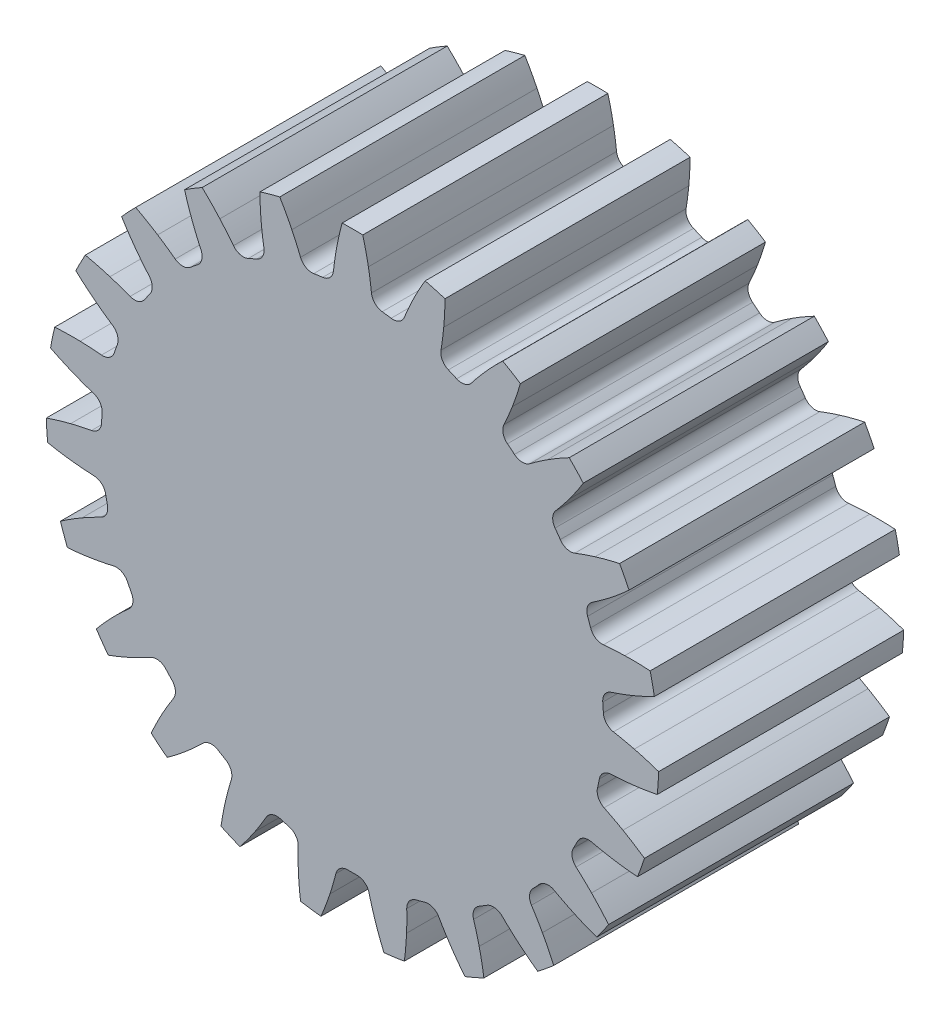
from build123d import *

# Parameters (mm, degrees)
BOSS_EXTRUDE1_DEPTH = 50


with BuildPart() as part:
    # Sketch1 → Boss-Extrude1 (new body)
    with BuildSketch(Plane.XY):
        with BuildLine():
            ThreePointArc((-6.067010261, 50.889624547), (-6.978540766, 50.772654734), (-7.887827325, 50.639359002))
            ThreePointArc((-7.887827325, 50.639359002), (-9.506716456, 50.935415462), (-10.590798202, 52.173647351))
            ThreePointArc((-10.590798202, 52.173647351), (-11.440918064, 54.179954393), (-12.359033088, 56.15607092))
            ThreePointArc((-12.359033088, 56.15607092), (-13.543777735, 58.463181503), (-14.830650776, 60.714922363))
            ThreePointArc((-14.830650776, 60.714922363), (-16.862298197, 60.182330459), (-18.874903383, 59.581775924))
            ThreePointArc((-18.874903383, 59.581775924), (-18.80446427, 56.989206262), (-18.617995455, 54.402391907))
            ThreePointArc((-18.617995455, 54.402391907), (-18.375692316, 52.23692177), (-18.059606285, 50.080985467))
            ThreePointArc((-18.059606285, 50.080985467), (-18.342501349, 48.459744637), (-19.571885451, 47.365639444))
            ThreePointArc((-19.571885451, 47.365639444), (-20.418055855, 47.007079202), (-21.257660843, 46.633403859))
            ThreePointArc((-21.257660843, 46.633403859), (-22.89639225, 46.481710683), (-24.274344271, 47.38154382))
            ThreePointArc((-24.274344271, 47.38154382), (-25.634234544, 49.08409196), (-27.05145323, 50.739224256))
            ThreePointArc((-27.05145323, 50.739224256), (-28.814715318, 52.641140641), (-30.661380029, 54.46218665))
            ThreePointArc((-30.661380029, 54.46218665), (-32.473996877, 53.401212784), (-34.249941528, 52.27993406))
            ThreePointArc((-34.249941528, 52.27993406), (-33.482647565, 49.802508158), (-32.60517936, 47.361928581))
            ThreePointArc((-32.60517936, 47.361928581), (-31.787624627, 45.342132556), (-30.90159527, 43.351423209))
            ThreePointArc((-30.90159527, 43.351423209), (-30.736594276, 41.713978213), (-31.625203432, 40.328761546))
            ThreePointArc((-31.625203432, 40.328761546), (-32.343257147, 39.755203649), (-33.050910904, 39.168862486))
            ThreePointArc((-33.050910904, 39.168862486), (-34.587947376, 38.580670061), (-36.157573272, 39.075367939))
            ThreePointArc((-36.157573272, 39.075367939), (-37.926377116, 40.347886971), (-39.737590838, 41.559281447))
            ThreePointArc((-39.737590838, 41.559281447), (-41.948597285, 42.914947194), (-44.218094992, 44.170239701))
            ThreePointArc((-44.218094992, 44.170239701), (-45.677247767, 42.659571451), (-47.084818194, 41.100728651))
            ThreePointArc((-47.084818194, 41.100728651), (-45.677576063, 38.922185856), (-44.174186269, 36.808847679))
            ThreePointArc((-44.174186269, 36.808847679), (-42.842014238, 35.084524796), (-41.451754299, 33.406684212))
            ThreePointArc((-41.451754299, 33.406684212), (-40.851094617, 31.874476853), (-41.333024751, 30.300883897))
            ThreePointArc((-41.333024751, 30.300883897), (-41.869707017, 29.554866508), (-42.3929261, 28.799345768))
            ThreePointArc((-42.3929261, 28.799345768), (-43.714272674, 27.818277637), (-45.359160474, 27.871150776))
            ThreePointArc((-45.359160474, 27.871150776), (-47.405693799, 28.619263784), (-49.476573122, 29.297076853))
            ThreePointArc((-49.476573122, 29.297076853), (-51.971343693, 30.005948437), (-54.495356134, 30.602388139))
            ThreePointArc((-54.495356134, 30.602388139), (-55.49282615, 28.754064858), (-56.427629293, 26.873270221))
            ThreePointArc((-56.427629293, 26.873270221), (-54.484807706, 25.155183086), (-52.466995867, 23.525822933))
            ThreePointArc((-52.466995867, 23.525822933), (-50.719007642, 22.224858333), (-48.927626341, 20.984324272))
            ThreePointArc((-48.927626341, 20.984324272), (-47.935856151, 19.670991361), (-47.97536471, 18.025728307))
            ThreePointArc((-47.97536471, 18.025728307), (-48.290872259, 17.162580124), (-48.590851903, 16.293913322))
            ThreePointArc((-48.590851903, 16.293913322), (-49.598510347, 14.99273082), (-51.196666248, 14.599857862))
            ThreePointArc((-51.196666248, 14.599857862), (-53.36914704, 14.768080728), (-55.546104317, 14.862042094))
            ThreePointArc((-55.546104317, 14.862042094), (-58.139613292, 14.871545752), (-60.730946011, 14.764897445))
            ThreePointArc((-60.730946011, 14.764897445), (-61.19275548, 12.716000816), (-61.585461266, 10.652744276))
            ThreePointArc((-61.585461266, 10.652744276), (-59.251150412, 9.522535464), (-56.868568402, 8.497995524))
            ThreePointArc((-56.868568402, 8.497995524), (-54.834404274, 7.7168758), (-52.774760166, 7.005652998))
            ThreePointArc((-52.774760166, 7.005652998), (-51.465434526, 6.008598429), (-51.059591341, 4.41368691))
            ThreePointArc((-51.059591341, 4.41368691), (-51.130524421, 3.497423685), (-51.185016508, 2.580035865))
            ThreePointArc((-51.185016508, 2.580035865), (-51.804253406, 1.055241745), (-53.237149495, 0.245760281))
            ThreePointArc((-53.237149495, 0.245760281), (-55.374454792, -0.178383317), (-57.496035061, -0.675242337))
            ThreePointArc((-57.496035061, -0.675242337), (-59.995933745, -1.365811448), (-62.462399448, -2.167638148))
            ThreePointArc((-62.462399448, -2.167638148), (-62.354298074, -4.265150835), (-62.175781312, -6.357846978))
            ThreePointArc((-62.175781312, -6.357846978), (-59.623106348, -6.816355051), (-57.052459375, -7.160089337))
            ThreePointArc((-57.052459375, -7.160089337), (-54.882983991, -7.363432109), (-52.707831458, -7.49259551))
            ThreePointArc((-52.707831458, -7.49259551), (-51.178057062, -8.099424762), (-50.356961664, -9.525697454))
            ThreePointArc((-50.356961664, -9.525697454), (-50.178059494, -10.427120669), (-49.983022595, -11.325191049))
            ThreePointArc((-49.983022595, -11.325191049), (-50.167911978, -12.960509782), (-51.329276908, -14.126564217))
            ThreePointArc((-51.329276908, -14.126564217), (-53.272892554, -15.111617487), (-55.181747912, -16.162447134))
            ThreePointArc((-55.181747912, -16.162447134), (-57.402630255, -17.501872662), (-59.561302465, -18.939409935))
            ThreePointArc((-59.561302465, -18.939409935), (-58.891307632, -20.929975761), (-58.154808094, -22.896905808))
            ThreePointArc((-58.154808094, -22.896905808), (-55.573089245, -22.649707694), (-53.005030433, -22.287143127))
            ThreePointArc((-53.005030433, -22.287143127), (-50.861143858, -21.897627944), (-48.731804013, -21.435152486))
            ThreePointArc((-48.731804013, -21.435152486), (-47.095037228, -21.60675067), (-45.919586508, -22.758604415))
            ThreePointArc((-45.919586508, -22.758604415), (-45.504117443, -23.578333184), (-45.074016553, -24.390480352))
            ThreePointArc((-45.074016553, -24.390480352), (-44.810846022, -26.01503959), (-45.614546669, -27.451186071))
            ThreePointArc((-45.614546669, -27.451186071), (-47.220323582, -28.92409212), (-48.77488296, -30.450957164))
            ThreePointArc((-48.77488296, -30.450957164), (-50.552036278, -32.339900045), (-52.242816152, -34.30653233))
            ThreePointArc((-52.242816152, -34.30653233), (-51.060618313, -36.042520132), (-49.820758799, -37.73780588))
            ThreePointArc((-49.820758799, -37.73780588), (-47.401470341, -36.803235134), (-45.026460866, -35.761261469))
            ThreePointArc((-45.026460866, -35.761261469), (-43.06716536, -34.80777689), (-41.141561598, -33.787962261))
            ThreePointArc((-41.141561598, -33.787962261), (-39.51919393, -33.511602725), (-38.07656569, -34.3036098))
            ThreePointArc((-38.07656569, -34.3036098), (-37.455343169, -34.98084859), (-36.822076903, -35.646839307))
            ThreePointArc((-36.822076903, -35.646839307), (-36.130364612, -37.140152922), (-36.516794176, -38.739879035))
            ThreePointArc((-36.516794176, -38.739879035), (-37.665639229, -40.591399158), (-38.750608069, -42.481059006))
            ThreePointArc((-38.750608069, -42.481059006), (-39.952229031, -44.779424988), (-41.049719161, -47.129296163))
            ThreePointArc((-41.049719161, -47.129296163), (-39.44299652, -48.481955669), (-37.79173174, -49.779865529))
            ThreePointArc((-37.79173174, -49.779865529), (-35.71430123, -48.227234987), (-33.70848468, -46.583130644))
            ThreePointArc((-33.70848468, -46.583130644), (-32.079092226, -45.136392258), (-30.500037769, -43.634873445))
            ThreePointArc((-30.500037769, -43.634873445), (-29.012392805, -42.931052512), (-27.409580182, -43.304473374))
            ThreePointArc((-27.409580182, -43.304473374), (-26.628677439, -43.788994483), (-25.839212259, -44.259435263))
            ThreePointArc((-25.839212259, -44.259435263), (-24.770259345, -45.510751016), (-24.710758112, -47.155412394))
            ThreePointArc((-24.710758112, -47.155412394), (-25.317466723, -49.248227815), (-25.85237785, -51.360535039))
            ThreePointArc((-25.85237785, -51.360535039), (-26.389347726, -53.897864832), (-26.812152289, -56.456695702))
            ThreePointArc((-26.812152289, -56.456695702), (-24.900068115, -57.325706344), (-22.959864822, -58.12998028))
            ThreePointArc((-22.959864822, -58.12998028), (-21.378365779, -56.074441446), (-19.89050439, -53.950142123))
            ThreePointArc((-19.89050439, -53.950142123), (-18.711859574, -52.117447898), (-17.596465667, -50.245585682))
            ThreePointArc((-17.596465667, -50.245585682), (-16.35387523, -49.16650253), (-14.709751504, -49.093642264))
            ThreePointArc((-14.709751504, -49.093642264), (-13.827084522, -49.349510977), (-12.939971448, -49.58951138))
            ThreePointArc((-12.939971448, -49.58951138), (-11.573057258, -50.506024906), (-11.072038163, -52.073644538))
            ThreePointArc((-11.072038163, -52.073644538), (-11.09161353, -54.25254071), (-11.036795032, -56.430835147))
            ThreePointArc((-11.036795032, -56.430835147), (-10.869289223, -59.018946607), (-10.586050739, -61.596960394))
            ThreePointArc((-10.586050739, -61.596960394), (-8.510415569, -61.917871627), (-6.425169766, -62.16886032))
            ThreePointArc((-6.425169766, -62.16886032), (-5.456894737, -59.762863106), (-4.597336383, -57.315918366))
            ThreePointArc((-4.597336383, -57.315918366), (-3.956853898, -55.233190849), (-3.387844205, -53.129812687))
            ThreePointArc((-3.387844205, -53.129812687), (-2.482465542, -51.755497977), (-0.918967848, -51.241760295))
            ThreePointArc((-0.918967848, -51.241760295), (0, -51.25), (0.918967848, -51.241760295))
            ThreePointArc((0.918967848, -51.241760295), (2.482465542, -51.755497977), (3.387844205, -53.129812687))
            ThreePointArc((3.387844205, -53.129812687), (3.956853898, -55.233190849), (4.597336383, -57.315918366))
            ThreePointArc((4.597336383, -57.315918366), (5.456894737, -59.762863106), (6.425169766, -62.16886032))
            ThreePointArc((6.425169766, -62.16886032), (8.510415569, -61.917871627), (10.586050739, -61.596960394))
            ThreePointArc((10.586050739, -61.596960394), (10.869289223, -59.018946607), (11.036795032, -56.430835147))
            ThreePointArc((11.036795032, -56.430835147), (11.09161353, -54.25254071), (11.072038163, -52.073644538))
            ThreePointArc((11.072038163, -52.073644538), (11.573057258, -50.506024906), (12.939971448, -49.58951138))
            ThreePointArc((12.939971448, -49.58951138), (13.827084522, -49.349510977), (14.709751504, -49.093642264))
            ThreePointArc((14.709751504, -49.093642264), (16.35387523, -49.16650253), (17.596465667, -50.245585682))
            ThreePointArc((17.596465667, -50.245585682), (18.711859574, -52.117447898), (19.89050439, -53.950142123))
            ThreePointArc((19.89050439, -53.950142123), (21.378365779, -56.074441446), (22.959864822, -58.12998028))
            ThreePointArc((22.959864822, -58.12998028), (24.900068115, -57.325706344), (26.812152289, -56.456695702))
            ThreePointArc((26.812152289, -56.456695702), (26.389347726, -53.897864832), (25.85237785, -51.360535039))
            ThreePointArc((25.85237785, -51.360535039), (25.317466723, -49.248227815), (24.710758112, -47.155412394))
            ThreePointArc((24.710758112, -47.155412394), (24.770259345, -45.510751016), (25.839212259, -44.259435263))
            ThreePointArc((25.839212259, -44.259435263), (26.628677439, -43.788994483), (27.409580182, -43.304473374))
            ThreePointArc((27.409580182, -43.304473374), (29.012392805, -42.931052512), (30.500037769, -43.634873445))
            ThreePointArc((30.500037769, -43.634873445), (32.079092226, -45.136392258), (33.70848468, -46.583130644))
            ThreePointArc((33.70848468, -46.583130644), (35.71430123, -48.227234987), (37.79173174, -49.779865529))
            ThreePointArc((37.79173174, -49.779865529), (39.44299652, -48.481955669), (41.049719161, -47.129296163))
            ThreePointArc((41.049719161, -47.129296163), (39.952229031, -44.779424988), (38.750608069, -42.481059006))
            ThreePointArc((38.750608069, -42.481059006), (37.665639229, -40.591399158), (36.516794176, -38.739879035))
            ThreePointArc((36.516794176, -38.739879035), (36.130364612, -37.140152922), (36.822076903, -35.646839307))
            ThreePointArc((36.822076903, -35.646839307), (37.455343169, -34.98084859), (38.07656569, -34.3036098))
            ThreePointArc((38.07656569, -34.3036098), (39.51919393, -33.511602725), (41.141561598, -33.787962261))
            ThreePointArc((41.141561598, -33.787962261), (43.06716536, -34.80777689), (45.026460866, -35.761261469))
            ThreePointArc((45.026460866, -35.761261469), (47.401470341, -36.803235134), (49.820758799, -37.73780588))
            ThreePointArc((49.820758799, -37.73780588), (51.060618313, -36.042520132), (52.242816152, -34.30653233))
            ThreePointArc((52.242816152, -34.30653233), (50.552036278, -32.339900045), (48.77488296, -30.450957164))
            ThreePointArc((48.77488296, -30.450957164), (47.220323582, -28.92409212), (45.614546669, -27.451186071))
            ThreePointArc((45.614546669, -27.451186071), (44.810846022, -26.01503959), (45.074016553, -24.390480352))
            ThreePointArc((45.074016553, -24.390480352), (45.504117443, -23.578333184), (45.919586508, -22.758604415))
            ThreePointArc((45.919586508, -22.758604415), (47.095037228, -21.60675067), (48.731804013, -21.435152486))
            ThreePointArc((48.731804013, -21.435152486), (50.861143858, -21.897627944), (53.005030433, -22.287143127))
            ThreePointArc((53.005030433, -22.287143127), (55.573089245, -22.649707694), (58.154808094, -22.896905808))
            ThreePointArc((58.154808094, -22.896905808), (58.891307632, -20.929975761), (59.561302465, -18.939409935))
            ThreePointArc((59.561302465, -18.939409935), (57.402630255, -17.501872662), (55.181747912, -16.162447134))
            ThreePointArc((55.181747912, -16.162447134), (53.272892554, -15.111617487), (51.329276908, -14.126564217))
            ThreePointArc((51.329276908, -14.126564217), (50.167911978, -12.960509782), (49.983022595, -11.325191049))
            ThreePointArc((49.983022595, -11.325191049), (50.178059494, -10.427120669), (50.356961664, -9.525697454))
            ThreePointArc((50.356961664, -9.525697454), (51.178057062, -8.099424762), (52.707831458, -7.49259551))
            ThreePointArc((52.707831458, -7.49259551), (54.882983991, -7.363432109), (57.052459375, -7.160089337))
            ThreePointArc((57.052459375, -7.160089337), (59.623106348, -6.816355051), (62.175781312, -6.357846978))
            ThreePointArc((62.175781312, -6.357846978), (62.354298074, -4.265150835), (62.462399448, -2.167638148))
            ThreePointArc((62.462399448, -2.167638148), (59.995933745, -1.365811448), (57.496035061, -0.675242337))
            ThreePointArc((57.496035061, -0.675242337), (55.374454792, -0.178383317), (53.237149495, 0.245760281))
            ThreePointArc((53.237149495, 0.245760281), (51.804253406, 1.055241745), (51.185016508, 2.580035865))
            ThreePointArc((51.185016508, 2.580035865), (51.130524421, 3.497423685), (51.059591341, 4.41368691))
            ThreePointArc((51.059591341, 4.41368691), (51.465434526, 6.008598429), (52.774760166, 7.005652998))
            ThreePointArc((52.774760166, 7.005652998), (54.834404274, 7.7168758), (56.868568402, 8.497995524))
            ThreePointArc((56.868568402, 8.497995524), (59.251150412, 9.522535464), (61.585461266, 10.652744276))
            ThreePointArc((61.585461266, 10.652744276), (61.19275548, 12.716000816), (60.730946011, 14.764897445))
            ThreePointArc((60.730946011, 14.764897445), (58.139613292, 14.871545752), (55.546104317, 14.862042094))
            ThreePointArc((55.546104317, 14.862042094), (53.36914704, 14.768080728), (51.196666248, 14.599857862))
            ThreePointArc((51.196666248, 14.599857862), (49.598510347, 14.99273082), (48.590851903, 16.293913322))
            ThreePointArc((48.590851903, 16.293913322), (48.290872259, 17.162580124), (47.97536471, 18.025728307))
            ThreePointArc((47.97536471, 18.025728307), (47.935856151, 19.670991361), (48.927626341, 20.984324272))
            ThreePointArc((48.927626341, 20.984324272), (50.719007642, 22.224858333), (52.466995867, 23.525822933))
            ThreePointArc((52.466995867, 23.525822933), (54.484807706, 25.155183086), (56.427629293, 26.873270221))
            ThreePointArc((56.427629293, 26.873270221), (55.49282615, 28.754064858), (54.495356134, 30.602388139))
            ThreePointArc((54.495356134, 30.602388139), (51.971343693, 30.005948437), (49.476573122, 29.297076853))
            ThreePointArc((49.476573122, 29.297076853), (47.405693799, 28.619263784), (45.359160474, 27.871150776))
            ThreePointArc((45.359160474, 27.871150776), (43.714272674, 27.818277637), (42.3929261, 28.799345768))
            ThreePointArc((42.3929261, 28.799345768), (41.869707017, 29.554866508), (41.333024751, 30.300883897))
            ThreePointArc((41.333024751, 30.300883897), (40.851094617, 31.874476853), (41.451754299, 33.406684212))
            ThreePointArc((41.451754299, 33.406684212), (42.842014238, 35.084524796), (44.174186269, 36.808847679))
            ThreePointArc((44.174186269, 36.808847679), (45.677576063, 38.922185856), (47.084818194, 41.100728651))
            ThreePointArc((47.084818194, 41.100728651), (45.677247767, 42.659571451), (44.218094992, 44.170239701))
            ThreePointArc((44.218094992, 44.170239701), (41.948597285, 42.914947194), (39.737590838, 41.559281447))
            ThreePointArc((39.737590838, 41.559281447), (37.926377116, 40.347886971), (36.157573272, 39.075367939))
            ThreePointArc((36.157573272, 39.075367939), (34.587947376, 38.580670061), (33.050910904, 39.168862486))
            ThreePointArc((33.050910904, 39.168862486), (32.343257147, 39.755203649), (31.625203432, 40.328761546))
            ThreePointArc((31.625203432, 40.328761546), (30.736594276, 41.713978213), (30.90159527, 43.351423209))
            ThreePointArc((30.90159527, 43.351423209), (31.787624627, 45.342132556), (32.60517936, 47.361928581))
            ThreePointArc((32.60517936, 47.361928581), (33.482647565, 49.802508158), (34.249941528, 52.27993406))
            ThreePointArc((34.249941528, 52.27993406), (32.473996877, 53.401212784), (30.661380029, 54.46218665))
            ThreePointArc((30.661380029, 54.46218665), (28.814715318, 52.641140641), (27.05145323, 50.739224256))
            ThreePointArc((27.05145323, 50.739224256), (25.634234544, 49.08409196), (24.274344271, 47.38154382))
            ThreePointArc((24.274344271, 47.38154382), (22.89639225, 46.481710683), (21.257660843, 46.633403859))
            ThreePointArc((21.257660843, 46.633403859), (20.418055855, 47.007079202), (19.571885451, 47.365639444))
            ThreePointArc((19.571885451, 47.365639444), (18.342501349, 48.459744637), (18.059606285, 50.080985467))
            ThreePointArc((18.059606285, 50.080985467), (18.375692316, 52.23692177), (18.617995455, 54.402391907))
            ThreePointArc((18.617995455, 54.402391907), (18.80446427, 56.989206262), (18.874903383, 59.581775924))
            ThreePointArc((18.874903383, 59.581775924), (16.862298197, 60.182330459), (14.830650776, 60.714922363))
            ThreePointArc((14.830650776, 60.714922363), (13.543777735, 58.463181503), (12.359033088, 56.15607092))
            ThreePointArc((12.359033088, 56.15607092), (11.440918064, 54.179954393), (10.590798202, 52.173647351))
            ThreePointArc((10.590798202, 52.173647351), (9.506716456, 50.935415462), (7.887827325, 50.639359002))
            ThreePointArc((7.887827325, 50.639359002), (6.978540766, 50.772654734), (6.067010261, 50.889624547))
            ThreePointArc((6.067010261, 50.889624547), (4.588029008, 51.611473491), (3.878218919, 53.096270137))
            ThreePointArc((3.878218919, 53.096270137), (3.600918969, 55.257537465), (3.25, 57.4080787))
            ThreePointArc((3.25, 57.4080787), (2.731639884, 59.949275645), (2.1, 62.464710037))
            ThreePointArc((2.1, 62.464710037), (0, 62.5), (-2.1, 62.464710037))
            ThreePointArc((-2.1, 62.464710037), (-2.731639884, 59.949275645), (-3.25, 57.4080787))
            ThreePointArc((-3.25, 57.4080787), (-3.600918969, 55.257537465), (-3.878218919, 53.096270137))
            ThreePointArc((-3.878218919, 53.096270137), (-4.588029008, 51.611473491), (-6.067010261, 50.889624547))
        make_face()
    extrude(amount=BOSS_EXTRUDE1_DEPTH)


solid = part.part
